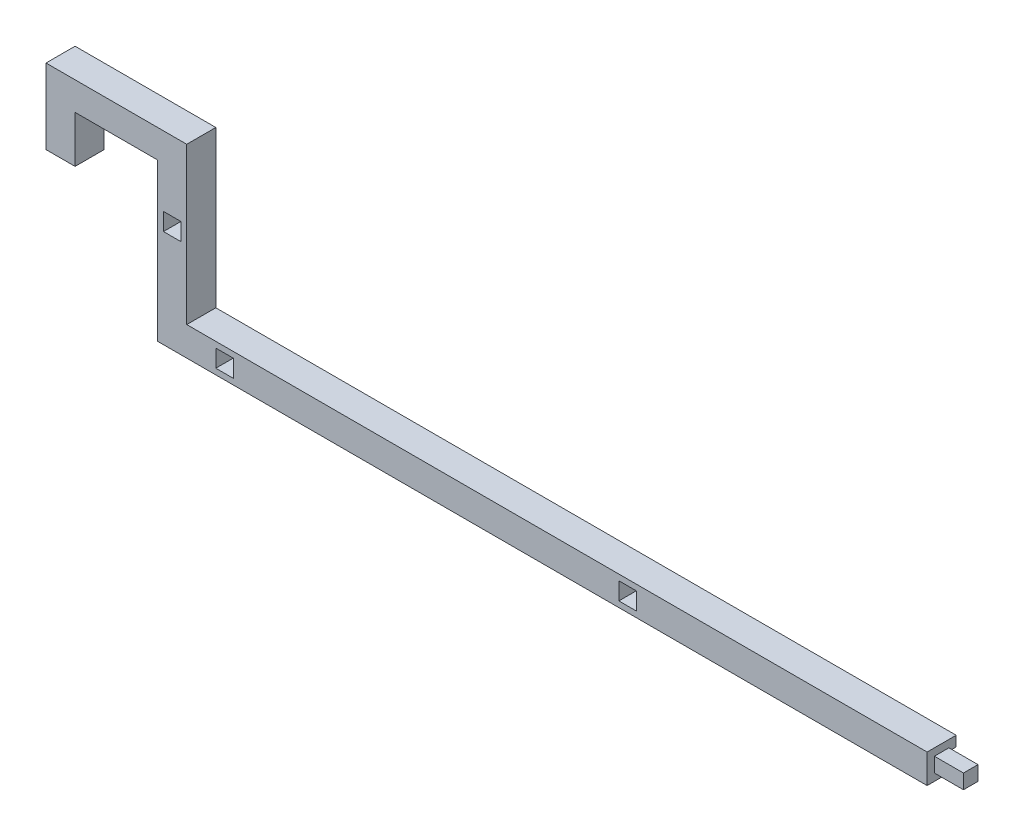
from build123d import *

# Parameters (mm, degrees)
BOSS_EXTRUDE1_DEPTH = 5
SKETCH2_W           = 2.5
SKETCH2_H           = 2.5
BOSS_EXTRUDE2_DEPTH = 5
SKETCH3_W           = 3
SKETCH3_H           = 3
CUT_EXTRUDE1_DEPTH  = 10
SKETCH5_W           = 3
SKETCH5_H           = 3
CUT_EXTRUDE3_DEPTH  = 12
SKETCH6_W           = 132.3
SKETCH6_H           = 1.5
CUT_EXTRUDE4_DEPTH  = 2


with BuildPart() as part:
    # Sketch1 → Boss-Extrude1 (new body)
    with BuildSketch(Plane.XY):
        Polygon((0, 6.7), (0, 8.05), (5.5, 8.05), (14.2, 8.05), (14.2, -18.95), (146.5, -18.95), (146.5, -13.95), (19.2, -13.95), (19.2, 12.9), (5.5, 12.9), (-5, 12.9), (-5, 0), (0, 0), align=None)
    extrude(amount=BOSS_EXTRUDE1_DEPTH)

    # Sketch2 → Boss-Extrude2 (add)
    with BuildSketch(Plane(origin=(146.5, 0, 0), x_dir=(0, 0, -1), z_dir=(1, 0, 0))):
        with Locations((-2.5, -16.45)):
            Rectangle(SKETCH2_W, SKETCH2_H)
    extrude(amount=BOSS_EXTRUDE2_DEPTH)

    # Sketch3 → Cut-Extrude1 (cut)
    with BuildSketch(Plane.XY.offset(5)):
        with Locations((16.7, -0.6)):
            Rectangle(SKETCH3_W, SKETCH3_H)
    extrude(amount=-CUT_EXTRUDE1_DEPTH, mode=Mode.SUBTRACT)

    # Sketch5 → Cut-Extrude3 (cut)
    with BuildSketch(Plane(origin=(0, 0, 0), x_dir=(-1, 0, 0), z_dir=(0, 0, -1))):
        with Locations((-25.7, -16.45)):
            Rectangle(SKETCH5_W, SKETCH5_H)
        with Locations((-95, -16.45)):
            Rectangle(SKETCH5_W, SKETCH5_H)
    extrude(amount=-CUT_EXTRUDE3_DEPTH, mode=Mode.SUBTRACT)

    # Sketch6 → Cut-Extrude4 (cut)
    with BuildSketch(Plane(origin=(0, 0, 0), x_dir=(-1, 0, 0), z_dir=(0, 0, -1))):
        with Locations((-80.35, -16.45)):
            Rectangle(SKETCH6_W, SKETCH6_H)
    extrude(amount=-CUT_EXTRUDE4_DEPTH, mode=Mode.SUBTRACT)


solid = part.part
